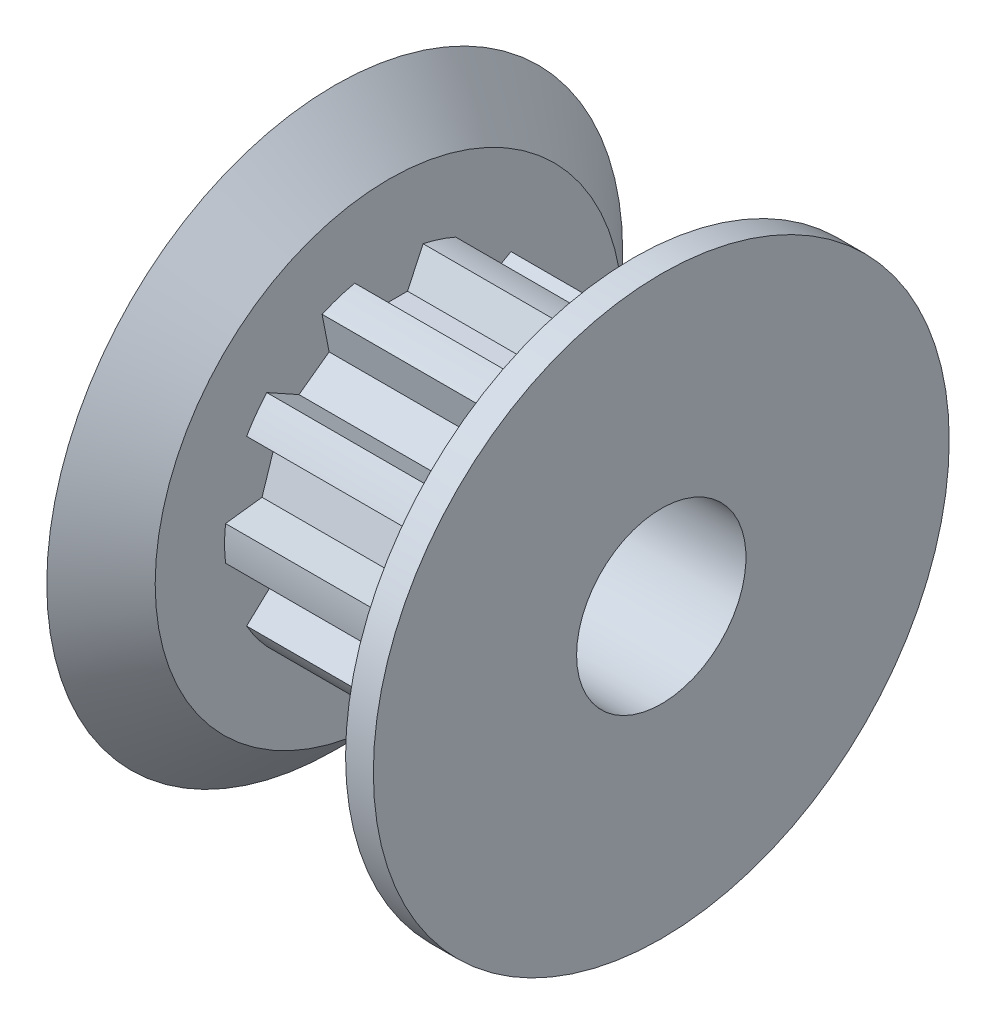
from build123d import *

# Parameters (mm, degrees)
SKETCH4_R          = 3.2385
SKETCH4_R_2        = 3.07975
CUT_EXTRUDE2_DEPTH = 4.064
CUT_EXTRUDE1_DEPTH = 4.064
CIRPATTERN1_COUNT  = 10


with BuildPart() as part:
    # Sketch1 → Revolve1 (revolve)
    with BuildSketch(Plane.XY, mode=Mode.PRIVATE) as revolve1_sk:
        with BuildLine():
            Line((-0.5588, 5.3975), (-0.5588, 1.5875))
            Line((-0.5588, 1.5875), (5.5626, 1.5875))
            Line((5.5626, 1.5875), (5.5626, 5.3975))
            Line((5.5626, 5.3975), (5.0419, 5.3975))
            ThreePointArc((5.0419, 5.3975), (4.654699632, 4.645356921), (4.5212, 3.81))
            Line((4.5212, 3.81), (4.5212, 3.2385))
            Line((4.5212, 3.2385), (0.4572, 3.2385))
            Line((0.4572, 3.2385), (0.4572, 4.3815))
            Line((0.4572, 4.3815), (-0.5588, 5.3975))
        make_face()
    revolve(revolve1_sk.sketch.rotate(Axis((-5.5626, 0, 0), (1, 0, 0)), 90), axis=Axis((-5.5626, 0, 0), (1, 0, 0)))

    # Sketch4 → Cut-Extrude2 (cut)
    with BuildSketch(Plane(origin=(0.4572, 0, 0), x_dir=(0, 0, -1), z_dir=(1, 0, 0))):
        Circle(SKETCH4_R)
        Circle(SKETCH4_R_2, mode=Mode.SUBTRACT)
    extrude(amount=CUT_EXTRUDE2_DEPTH, mode=Mode.SUBTRACT)

    # Sketch3 → Cut-Extrude1 (cut)
    with BuildSketch(Plane(origin=(0.4572, 0, 0), x_dir=(0, 0, -1), z_dir=(1, 0, 0))):
        with BuildLine():
            Line((-0.640454656, 3.012420604), (-0.349102168, 2.387613176))
            Line((-0.349102168, 2.387613176), (0.349102168, 2.387613176))
            Line((0.349102168, 2.387613176), (0.640454656, 3.012420604))
            ThreePointArc((0.640454656, 3.012420604), (0, 3.07975), (-0.640454656, 3.012420604))
        make_face()
    cut_extrude1 = extrude(amount=CUT_EXTRUDE1_DEPTH, mode=Mode.SUBTRACT)

    # CirPattern1: Cut-Extrude1 ×10 about axis
    cirpattern1_axis = Axis((0, 0, 0), (1, 0, 0))
    for i in range(1, CIRPATTERN1_COUNT):
        add(cut_extrude1.rotate(cirpattern1_axis, i * 360 / CIRPATTERN1_COUNT), mode=Mode.SUBTRACT)


solid = part.part
